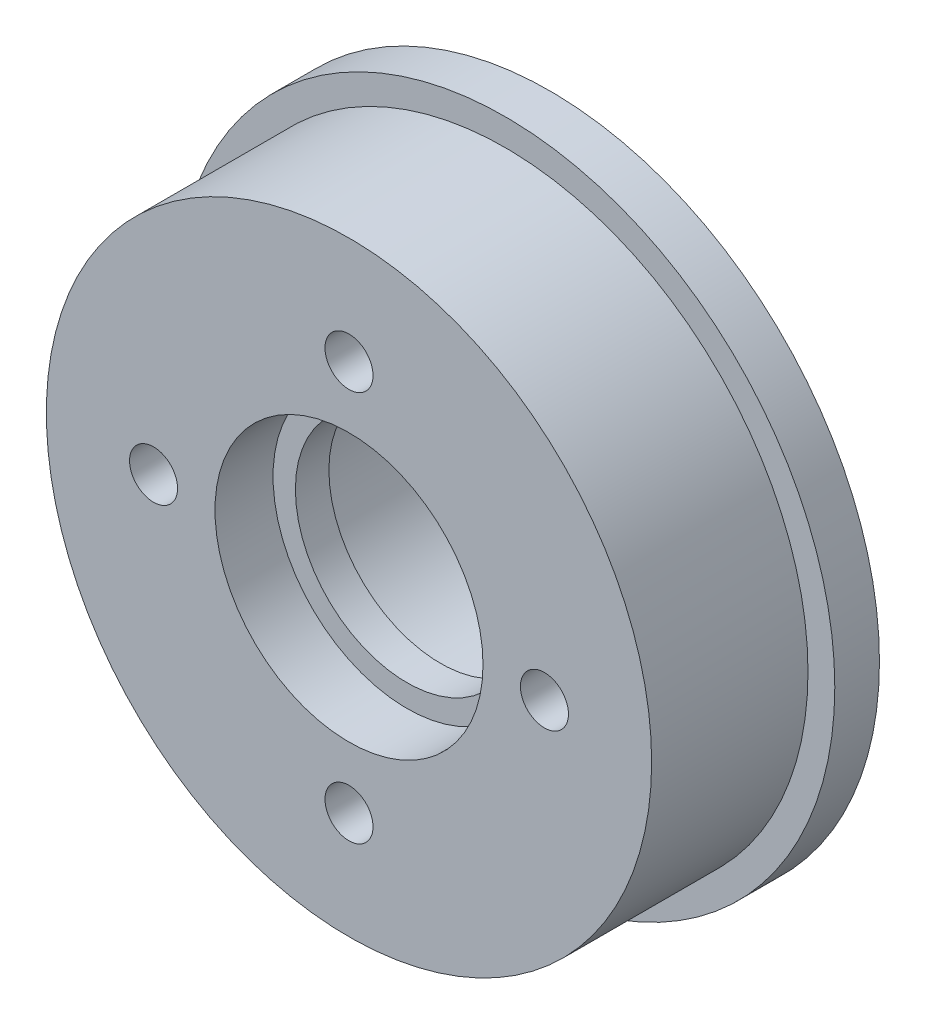
from build123d import *

# Parameters (mm, degrees)
SKETCH1_R           = 29.5
SKETCH1_R_2         = 27.1
BOSS_EXTRUDE1_DEPTH = 4
SKETCH1_3_R         = 27.1
SKETCH1_3_R_2       = 12
BOSS_EXTRUDE2_DEPTH = 18
BOSS_EXTRUDE3_START = 9.8
SKETCH1_4_R         = 12
SKETCH1_4_R_2       = 10
BOSS_EXTRUDE3_DEPTH = 3
SKETCH4_R           = 2.15
CUT_EXTRUDE1_DEPTH  = 6


with BuildPart() as part:
    # Sketch1 → Boss-Extrude1 (new body)
    with BuildSketch(Plane.XY):
        Circle(SKETCH1_R)
        Circle(SKETCH1_R_2, mode=Mode.SUBTRACT)
    extrude(amount=BOSS_EXTRUDE1_DEPTH)

    # Sketch1<3> → Boss-Extrude2 (add)
    with BuildSketch(Plane.XY):
        Circle(SKETCH1_3_R)
        Circle(SKETCH1_3_R_2, mode=Mode.SUBTRACT)
    extrude(amount=BOSS_EXTRUDE2_DEPTH)

    # Sketch1<4> → Boss-Extrude3 (add)
    with BuildSketch(Plane.XY.offset(BOSS_EXTRUDE3_START)):
        Circle(SKETCH1_4_R)
        Circle(SKETCH1_4_R_2, mode=Mode.SUBTRACT)
    extrude(amount=BOSS_EXTRUDE3_DEPTH)

    # Sketch4 → Cut-Extrude1 (cut)
    with BuildSketch(Plane.XY.offset(18)):
        with Locations((0, 17.5)):
            Circle(SKETCH4_R)
        with Locations((17.5, 0)):
            Circle(SKETCH4_R)
        with Locations((0, -17.5)):
            Circle(SKETCH4_R)
        with Locations((-17.5, 0)):
            Circle(SKETCH4_R)
    extrude(amount=-CUT_EXTRUDE1_DEPTH, mode=Mode.SUBTRACT)


solid = part.part
